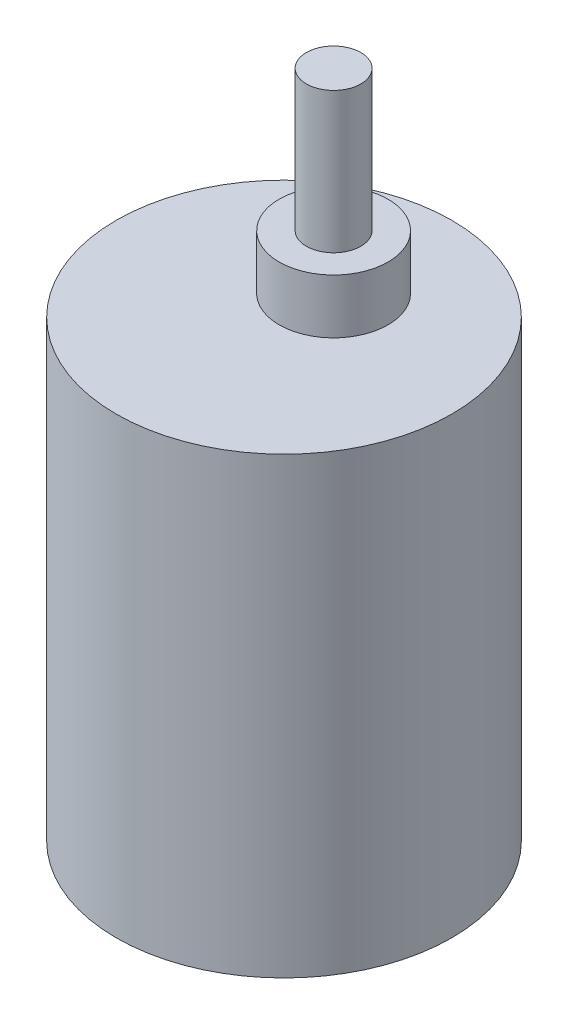
from build123d import *

# Parameters (mm, degrees)
SKETCH1_R      = 18.5
EXTRUDE1_DEPTH = 50
SKETCH2_R      = 6
EXTRUDE2_DEPTH = 6
SKETCH3_R      = 3
EXTRUDE3_DEPTH = 15.5


with BuildPart() as part:
    # Sketch1 → Extrude1 (new body)
    with BuildSketch(Plane(origin=(0, 0, 0), x_dir=(1, 0, 0), z_dir=(0, 1, 0))):
        with Locations(Location((0, 0, 0), (0, 0, 270))):
            Circle(SKETCH1_R)
    extrude(amount=EXTRUDE1_DEPTH)

    # Sketch2 → Extrude2 (add)
    with BuildSketch(Plane(origin=(0, 50, 0), x_dir=(1, 0, 0), z_dir=(0, 1, 0))):
        with Locations(Location((0.467490016, 5, 0), (0, 0, 270))):
            Circle(SKETCH2_R)
    extrude(amount=EXTRUDE2_DEPTH)

    # Sketch3 → Extrude3 (add)
    with BuildSketch(Plane(origin=(0, 56, 0), x_dir=(1, 0, 0), z_dir=(0, 1, 0))):
        with Locations(Location((0.467490016, 5, 0), (0, 0, 270))):
            Circle(SKETCH3_R)
    extrude(amount=EXTRUDE3_DEPTH)


solid = part.part
